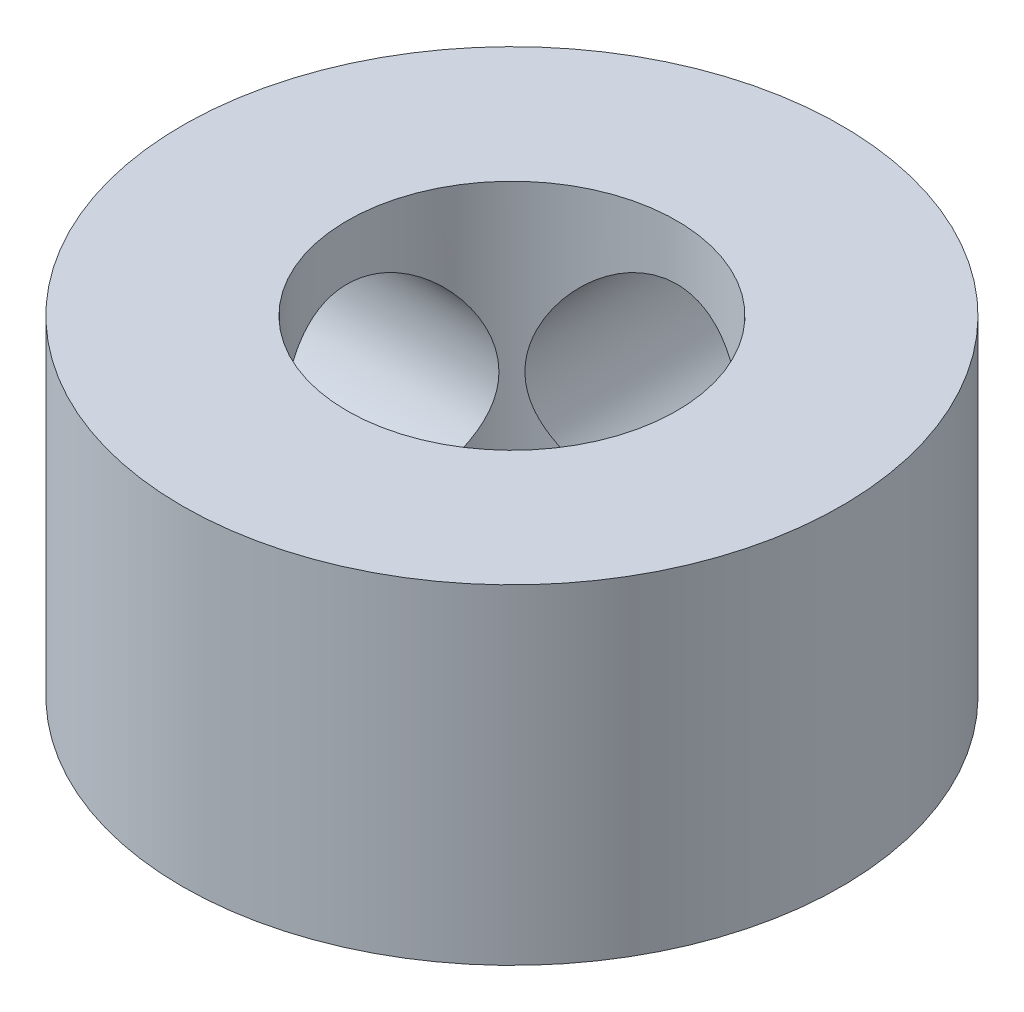
from build123d import *

# Parameters (mm, degrees)
SKETCH_1_R          = 6
SKETCH_1_R_2        = 3
EXTRUDE_1_DEPTH     = 6
SKETCH_2_R          = 2
CUT_EXTRUDE_1_DEPTH = 10
SKETCH_3_R          = 2
CUT_EXTRUDE_2_DEPTH = 10


with BuildPart() as part:
    # 草图1 → 凸台-拉伸1 (new body)
    with BuildSketch(Plane(origin=(0, 0, 0), x_dir=(1, 0, 0), z_dir=(0, 1, 0))):
        with Locations(Location((0, 0, 0), (0, 0, 270))):
            Circle(SKETCH_1_R)
        with Locations(Location((0, 0, 0), (0, 0, 270))):
            Circle(SKETCH_1_R_2, mode=Mode.SUBTRACT)
    extrude(amount=EXTRUDE_1_DEPTH)

    # 草图2 → 切除-拉伸1 (cut)
    with BuildSketch(Plane.XY):
        with Locations(Location((0, 3, 0), (0, 0, 90))):
            Circle(SKETCH_2_R)
    extrude(amount=-CUT_EXTRUDE_1_DEPTH, mode=Mode.SUBTRACT)

    # 草图3 → 切除-拉伸2 (cut)
    with BuildSketch(Plane(origin=(0, 0, 0), x_dir=(0, 0, -1), z_dir=(1, 0, 0))):
        with Locations((0, 3)):
            Circle(SKETCH_3_R)
    extrude(amount=-CUT_EXTRUDE_2_DEPTH, mode=Mode.SUBTRACT)


solid = part.part
